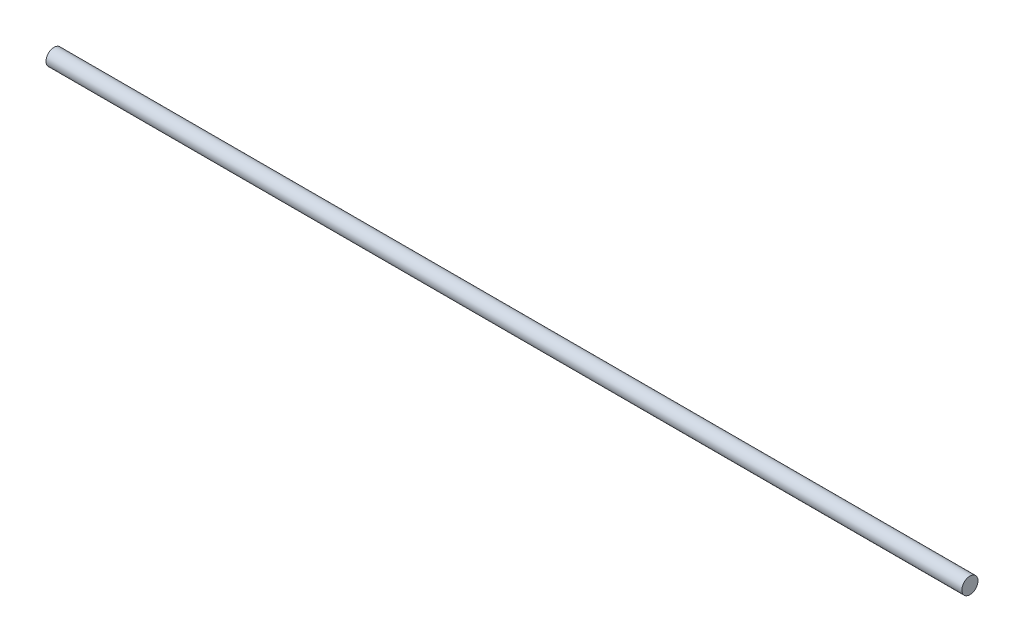
from build123d import *

# Parameters (mm, degrees)
SKETCH1_R           = 3
BOSS_EXTRUDE1_DEPTH = 170


with BuildPart() as part:
    # Sketch1 → Boss-Extrude1 (new, symmetric)
    with BuildSketch(Plane(origin=(0, 0, 0), x_dir=(0, 0, -1), z_dir=(1, 0, 0))):
        Circle(SKETCH1_R)
    extrude(amount=BOSS_EXTRUDE1_DEPTH, both=True)


solid = part.part
